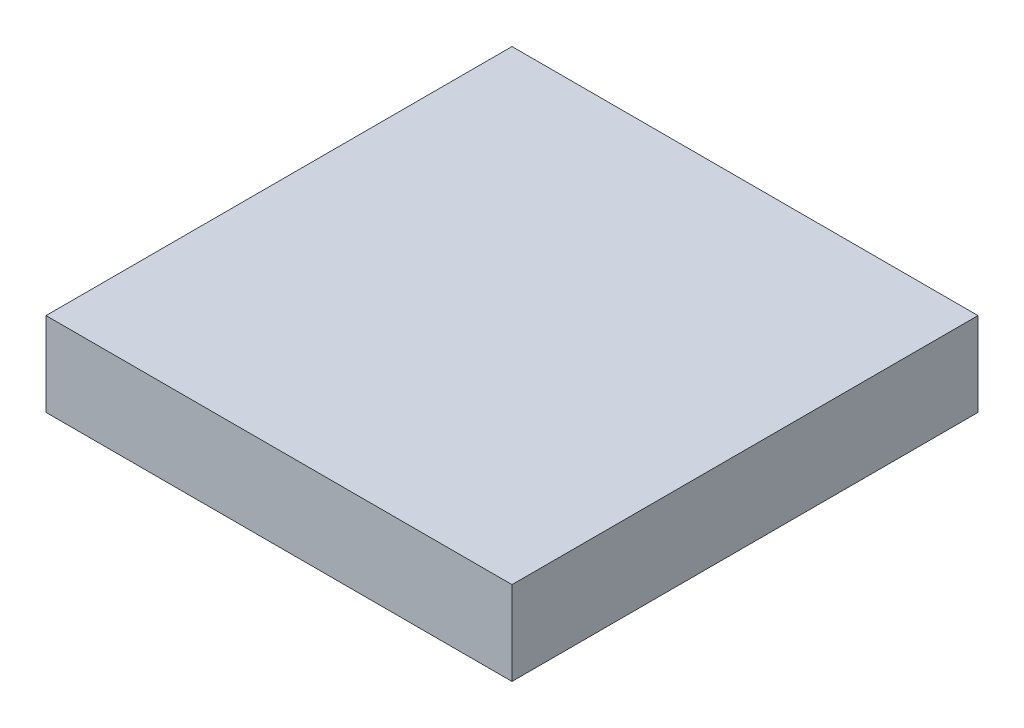
from build123d import *

# Parameters (mm, degrees)
SKETCH1_W           = 25
SKETCH1_H           = 25
BOSS_EXTRUDE1_DEPTH = 4.5


with BuildPart() as part:
    # Sketch1 → Boss-Extrude1 (new body)
    with BuildSketch(Plane(origin=(0, 0, 0), x_dir=(1, 0, 0), z_dir=(0, 1, 0))):
        Rectangle(SKETCH1_W, SKETCH1_H)
    extrude(amount=BOSS_EXTRUDE1_DEPTH)


solid = part.part
